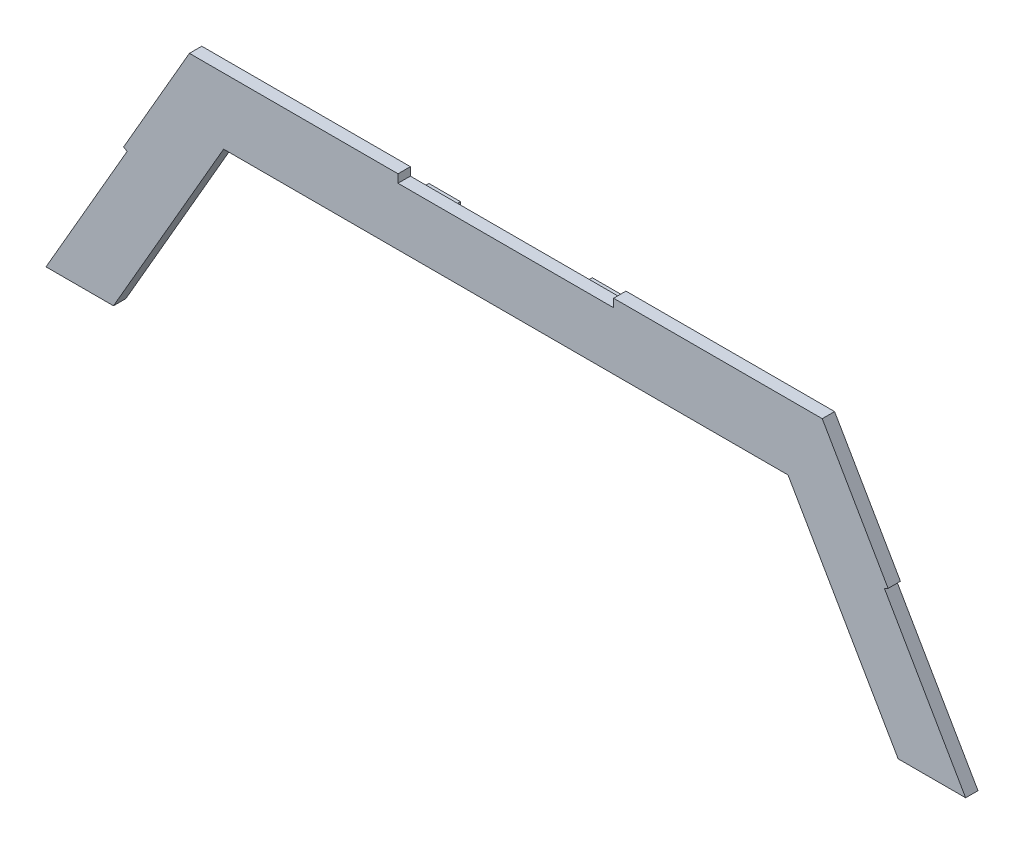
from build123d import *

# Parameters (mm, degrees)
BOSS_EXTRUDE1_DEPTH = 4.7625
CUT_EXTRUDE2_DEPTH  = 271.489940724
SKETCH3_W           = 12.192
SKETCH3_H           = 15.24
BOSS_EXTRUDE2_DEPTH = 3.175


with BuildPart() as part:
    # Sketch1 → Boss-Extrude1 (new body)
    with BuildSketch(Plane.XY):
        Polygon((-122.047, 202.560020285), (-179.197, 103.573316632), (-151.334076009, 103.573316632), (-108.848772846, 177.160020285), (108.848772846, 177.160020285), (151.334076009, 103.573316632), (179.197, 103.573316632), (122.047, 202.560020285), (41.573947838, 202.560020285), (41.591522776, 199.385068928), (-41.591522776, 199.385068928), (-41.573947838, 202.560020285), align=None)
    extrude(amount=BOSS_EXTRUDE1_DEPTH)

    # Sketch2 → Cut-Extrude2 (cut, through all)
    with BuildSketch(Plane.XY.offset(4.7625)):
        Polygon((183.007, 96.974203056), (181.632184671, 96.180453056), (146.072184671, 157.772179773), (147.447, 158.565929773), align=None)
        Polygon((-183.007, 96.974203056), (-181.632184671, 96.180453056), (-146.072184671, 157.772179773), (-147.447, 158.565929773), align=None)
    extrude(amount=-CUT_EXTRUDE2_DEPTH, mode=Mode.SUBTRACT)

    # Sketch3 → Boss-Extrude2 (add)
    with BuildSketch(Plane(origin=(0, 0, 0), x_dir=(-1, 0, 0), z_dir=(0, 0, -1))):
        with Locations((-31.496, 189.733068928)):
            Rectangle(SKETCH3_W, SKETCH3_H)
        with Locations((31.496, 189.733068928)):
            Rectangle(SKETCH3_W, SKETCH3_H)
    extrude(amount=BOSS_EXTRUDE2_DEPTH)


solid = part.part
